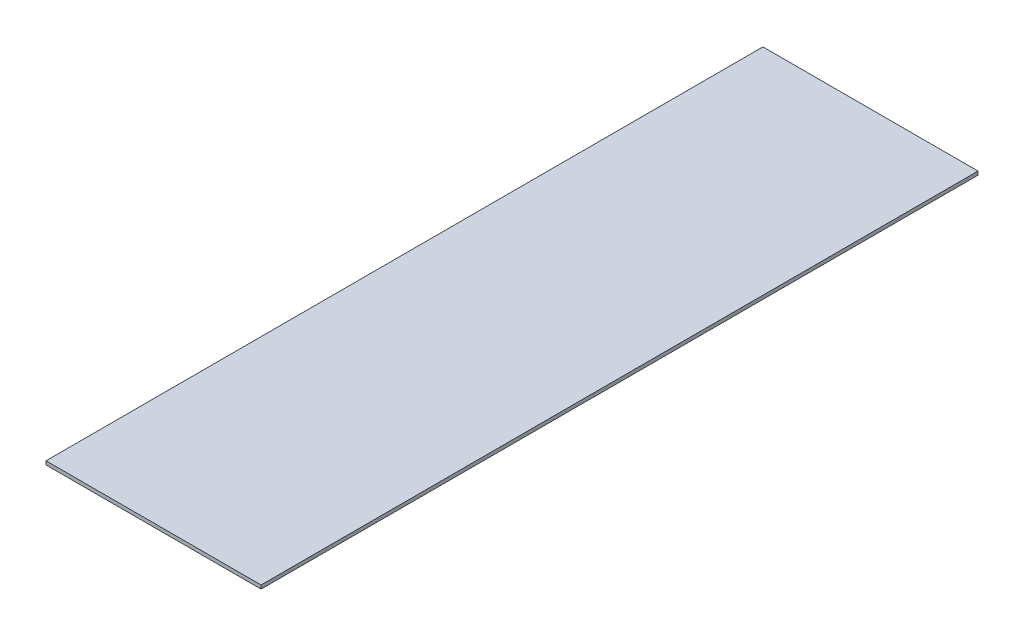
from build123d import *

# Parameters (mm, degrees)
SKETCH1_W           = 60
SKETCH1_H           = 200
BOSS_EXTRUDE1_DEPTH = 1


with BuildPart() as part:
    # Sketch1 → Boss-Extrude1 (new body)
    with BuildSketch(Plane(origin=(0, 0, 0), x_dir=(1, 0, 0), z_dir=(0, 1, 0))):
        with Locations((30, 0)):
            Rectangle(SKETCH1_W, SKETCH1_H)
    extrude(amount=BOSS_EXTRUDE1_DEPTH)


solid = part.part
